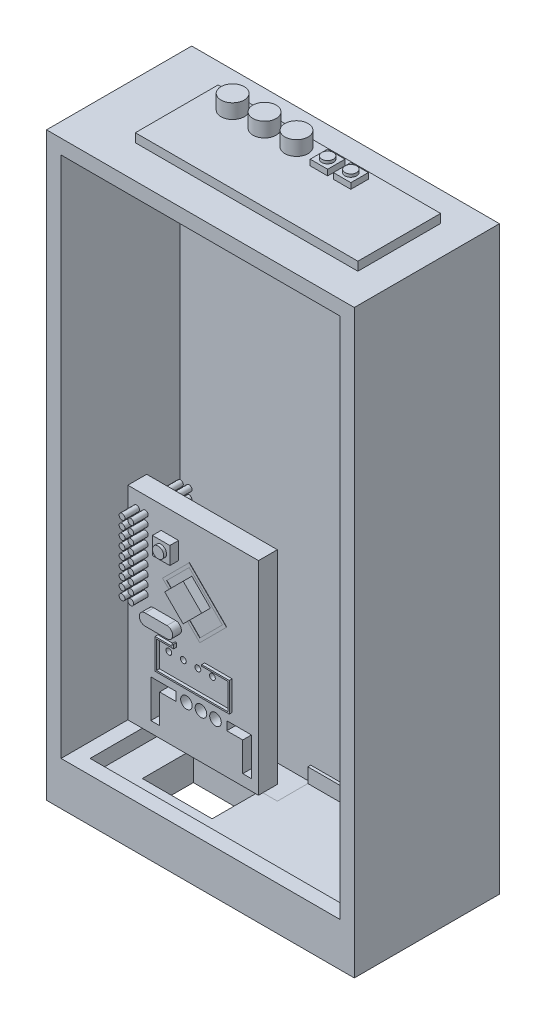
from build123d import *

# Parameters (mm, degrees)
SKETCH_1_W           = 106
SKETCH_1_H           = 45
EXTRUDE_1_DEPTH      = 200
SKETCH_2_W           = 86
SKETCH_2_H           = 180
CUT_EXTRUDE_1_DEPTH  = 35
SKETCH_4_W           = 24.030592061
SKETCH_4_H           = 7.207958271
CUT_EXTRUDE_4_DEPTH  = 35
SKETCH_5_W           = 106
SKETCH_5_H           = 200
EXTRUDE_2_DEPTH      = 5
SKETCH_6_W           = 96
SKETCH_6_H           = 180
CUT_EXTRUDE_5_DEPTH  = 41
SKETCH_7_W           = 45
SKETCH_7_H           = 70
EXTRUDE_3_DEPTH      = 18
SKETCH_8_W           = 24.030592061
SKETCH_8_H           = 17.559762173
CUT_EXTRUDE_6_DEPTH  = 15
SKETCH_9_R           = 3.5
CUT_EXTRUDE_7_DEPTH  = 211.926527492
SKETCH_11_W          = 6
SKETCH_11_H          = 6
SKETCH_11_R          = 1.925381926
EXTRUDE_5_DEPTH      = 3
SKETCH_12_R          = 1.925381926
EXTRUDE_6_DEPTH      = 1
EXTRUDE_7_DEPTH      = 3
EXTRUDE_12_DEPTH     = 3
SKETCH_23_R          = 2
CUT_EXTRUDE_8_DEPTH  = 12
EXTRUDE_1_2_DEPTH    = 0.1
SKETCH_25_W          = 45
SKETCH_25_H          = 5
CUT_EXTRUDE_9_DEPTH  = 75.1
SKETCH_26_W          = 45
SKETCH_26_H          = 6.5
CUT_EXTRUDE_10_DEPTH = 75.1
EXTRUDE_4_DEPTH      = 5
EXTRUDE_4_DEPTH_BACK = 15.1
SKETCH_10_R          = 1
EXTRUDE_14_DEPTH     = 1
SKETCH_28_R          = 1
CUT_EXTRUDE_11_DEPTH = 12.1
SKETCH_30_W          = 76.642846548
SKETCH_30_H          = 28.49978442
EXTRUDE_15_DEPTH     = 3
SKETCH_32_R          = 4
EXTRUDE_17_DEPTH     = 5
SKETCH_35_R          = 4
EXTRUDE_18_DEPTH     = 5
SKETCH_36_R          = 4
EXTRUDE_19_DEPTH     = 5
SKETCH_37_W          = 6
SKETCH_37_H          = 6
EXTRUDE_20_DEPTH     = 2
SKETCH_38_R          = 2
EXTRUDE_21_DEPTH     = 1
SKETCH_39_R          = 6
EXTRUDE_22_DEPTH     = 60
SKETCH_40_W          = 7.376516637
SKETCH_40_H          = 1.927531986
CUT_EXTRUDE_12_DEPTH = 23
SKETCH_41_W          = 4.263187749
SKETCH_41_H          = 1.482847913
CUT_EXTRUDE_13_DEPTH = 23
EXTRUDE_23_DEPTH     = 200
SKETCH_43_R          = 5.333844502
EXTRUDE_24_DEPTH     = 200
CUT_EXTRUDE_14_DEPTH = 207


with BuildPart() as part:
    # 草圖1 → Extrude 1 (new body)
    with BuildSketch(Plane(origin=(0, 0, 0), x_dir=(1, 0, 0), z_dir=(0, 1, 0))):
        Rectangle(SKETCH_1_W, SKETCH_1_H)
    extrude(amount=EXTRUDE_1_DEPTH)

    # 草圖2 → 除料-伸長1 (cut)
    with BuildSketch(Plane.XY.offset(22.5)):
        with Locations((0, 100)):
            Rectangle(SKETCH_2_W, SKETCH_2_H)
    extrude(amount=-CUT_EXTRUDE_1_DEPTH, mode=Mode.SUBTRACT)

    # 草圖4 → 除料-伸長4 (cut)
    with BuildSketch(Plane.XZ):
        with Locations((-20.984703969, 10.896020865)):
            Rectangle(SKETCH_4_W, SKETCH_4_H)
    extrude(amount=-CUT_EXTRUDE_4_DEPTH, mode=Mode.SUBTRACT)

    # 草圖5 → 填料-伸長2 (add)
    with BuildSketch(Plane.XY.offset(22.5)):
        with Locations((0, 100)):
            Rectangle(SKETCH_5_W, SKETCH_5_H)
    extrude(amount=EXTRUDE_2_DEPTH)

    # 草圖6 → 除料-伸長5 (cut)
    with BuildSketch(Plane.XY.offset(27.5)):
        with Locations((0, 105)):
            Rectangle(SKETCH_6_W, SKETCH_6_H)
    extrude(amount=-CUT_EXTRUDE_5_DEPTH, mode=Mode.SUBTRACT)

    # 草圖7 → 填料-伸長3 (add)
    with BuildSketch(Plane.XY.offset(-13.5)):
        with Locations((-25.5, 50)):
            Rectangle(SKETCH_7_W, SKETCH_7_H)
    extrude(amount=EXTRUDE_3_DEPTH)

    # 草圖8 → 除料-伸長6 (cut)
    with BuildSketch(Plane.XZ):
        with Locations((-20.984703969, 5.720118914)):
            Rectangle(SKETCH_8_W, SKETCH_8_H)
    extrude(amount=-CUT_EXTRUDE_6_DEPTH, mode=Mode.SUBTRACT)

    # 草圖9 → 除料-伸長7 (cut, through all)
    with BuildSketch(Plane.XY.offset(-13.5)):
        with Locations((-34, 185)):
            Circle(SKETCH_9_R)
        with Locations((-34, 175)):
            Circle(SKETCH_9_R)
        with Locations((34, 185)):
            Circle(SKETCH_9_R)
        with Locations((34, 175)):
            Circle(SKETCH_9_R)
    extrude(amount=-CUT_EXTRUDE_7_DEPTH, mode=Mode.SUBTRACT)

    # 草圖11 → 填料-伸長5 (add)
    with BuildSketch(Plane.XY.offset(4.5)):
        with Locations((-33.531491055, 74.249874948)):
            Rectangle(SKETCH_11_W, SKETCH_11_H)
        with Locations((-33.592516199, 74.152122505)):
            Circle(SKETCH_11_R, mode=Mode.SUBTRACT)
    extrude(amount=EXTRUDE_5_DEPTH)

    # 草圖14 → 填料-伸長7 (add)
    with BuildSketch(Plane.XY.offset(4.5)):
        Polygon((-32.310272291, 62.520068569), (-25.94631126, 68.8840296), (-19.582350229, 62.520068569), (-25.94631126, 56.156107538), align=None)
    extrude(amount=EXTRUDE_7_DEPTH)

    # 草圖22 → 填料-伸長12 (add)
    with BuildSketch(Plane.XY.offset(4.5)):
        with BuildLine():
            Line((-39.077631077, 52.868588224), (-31.528611444, 52.868588224))
            ThreePointArc((-31.528611444, 52.868588224), (-29.551487254, 50.891464034), (-31.528611444, 48.914339844))
            Line((-31.528611444, 48.914339844), (-39.077631077, 48.914339844))
            ThreePointArc((-39.077631077, 48.914339844), (-41.054755267, 50.891464034), (-39.077631077, 52.868588224))
        make_face()
    extrude(amount=EXTRUDE_12_DEPTH)

    # 草圖23 → 除料-伸長8 (cut)
    with BuildSketch(Plane.XY.offset(4.5)):
        with Locations((-27.814678515, 30.288524887)):
            Circle(SKETCH_23_R)
        with Locations((-22.814678515, 30.288524887)):
            Circle(SKETCH_23_R)
        with Locations((-17.814678515, 30.288524887)):
            Circle(SKETCH_23_R)
        Polygon((-40.074393657, 18.743194454), (-37.074393657, 18.743194454), (-37.074393657, 28.788524887), (-31.464475571, 28.788524887), (-31.464475571, 31.788524887), (-40.074393657, 31.788524887), align=None)
        Polygon((-8.423476487, 18.743194454), (-5.423476487, 18.743194454), (-5.423476487, 31.788524887), (-13.928865075, 31.788524887), (-13.928865075, 28.788524887), (-8.423476487, 28.788524887), align=None)
    extrude(amount=-CUT_EXTRUDE_8_DEPTH, mode=Mode.SUBTRACT)

    # 草圖24 → Extrude 1 2 (add)
    with BuildSketch(Plane.XY.offset(4.5)):
        Polygon((-26.761137533, 72.527282997), (-35.953525689, 63.334894842), (-23.117884135, 50.499253289), (-13.92549598, 59.691641444), align=None)
        Polygon((-26.761137533, 71.113069435), (-34.539312126, 63.334894842), (-23.117884135, 51.913466851), (-15.339709542, 59.691641444), align=None, mode=Mode.SUBTRACT)
    extrude(amount=EXTRUDE_1_2_DEPTH)

    # 草圖25 → 除料-伸長9 (cut)
    with BuildSketch(Plane(origin=(0, 85, 0), x_dir=(1, 0, 0), z_dir=(0, 1, 0))):
        with Locations((-25.5, 11)):
            Rectangle(SKETCH_25_W, SKETCH_25_H)
    extrude(amount=-CUT_EXTRUDE_9_DEPTH, mode=Mode.SUBTRACT)

    # 草圖26 → 除料-伸長10 (cut)
    with BuildSketch(Plane(origin=(0, 85, 0), x_dir=(1, 0, 0), z_dir=(0, 1, 0))):
        with Locations((-25.5, 5.25)):
            Rectangle(SKETCH_26_W, SKETCH_26_H)
    extrude(amount=-CUT_EXTRUDE_10_DEPTH, mode=Mode.SUBTRACT)

    # 草圖10 → 填料-伸長4 (add, two sides: drawn at the far end of the back side and taken through both)
    with BuildSketch(Plane.XY.offset(4.5).offset(-EXTRUDE_4_DEPTH_BACK)):
        with Locations((-45, 79.595847046)):
            Circle(SKETCH_10_R)
        with Locations((-42, 79.595847046)):
            Circle(SKETCH_10_R)
        with Locations((-45, 76.595847046)):
            Circle(SKETCH_10_R)
        with Locations((-42, 76.595847046)):
            Circle(SKETCH_10_R)
        with Locations((-45, 73.595847046)):
            Circle(SKETCH_10_R)
        with Locations((-42, 73.595847046)):
            Circle(SKETCH_10_R)
        with Locations((-45, 70.595847046)):
            Circle(SKETCH_10_R)
        with Locations((-42, 70.595847046)):
            Circle(SKETCH_10_R)
        with Locations((-45, 67.595847046)):
            Circle(SKETCH_10_R)
        with Locations((-42, 67.595847046)):
            Circle(SKETCH_10_R)
        with Locations((-45, 64.595847046)):
            Circle(SKETCH_10_R)
        with Locations((-42, 64.595847046)):
            Circle(SKETCH_10_R)
        with Locations((-45, 61.595847046)):
            Circle(SKETCH_10_R)
        with Locations((-42, 61.595847046)):
            Circle(SKETCH_10_R)
        with Locations((-45, 58.595847046)):
            Circle(SKETCH_10_R)
        with Locations((-42, 58.595847046)):
            Circle(SKETCH_10_R)
        with Locations((-45, 55.595847046)):
            Circle(SKETCH_10_R)
        with Locations((-42, 55.595847046)):
            Circle(SKETCH_10_R)
    extrude(amount=EXTRUDE_4_DEPTH + EXTRUDE_4_DEPTH_BACK)

    # 草圖27 → 填料-伸長14 (add)
    with BuildSketch(Plane.XY.offset(4.5)):
        Polygon((-31.203920225, 46.418342211), (-31.203920225, 45.064584038), (-37.135292794, 45.064584038), (-37.135292794, 35.684682041), (-12.561763296, 35.684682041), (-12.561763296, 44.710825865), (-21.548691432, 44.710825865), (-21.548691432, 45.210825865), (-12.061763296, 45.210825865), (-12.061763296, 35.184682041), (-37.635292794, 35.184682041), (-37.635292794, 45.564584038), (-31.703920225, 45.564584038), (-31.703920225, 46.418342211), align=None)
    extrude(amount=EXTRUDE_14_DEPTH)

    # 草圖28 → 除料-伸長11 (cut)
    with BuildSketch(Plane.XY.offset(4.5)):
        with Locations((-33.875530331, 42.407908174)):
            Circle(SKETCH_28_R)
        with Locations((-28.875530331, 42.407908174)):
            Circle(SKETCH_28_R)
        with Locations((-23.875530331, 42.407908174)):
            Circle(SKETCH_28_R)
        with Locations((-18.875530331, 42.407908174)):
            Circle(SKETCH_28_R)
    extrude(amount=-CUT_EXTRUDE_11_DEPTH, mode=Mode.SUBTRACT)

    # 草圖30 → 填料-伸長15 (add)
    with BuildSketch(Plane(origin=(0, 200, 0), x_dir=(1, 0, 0), z_dir=(0, 1, 0))):
        with Locations((4.482905335, -1.820850753)):
            Rectangle(SKETCH_30_W, SKETCH_30_H)
    extrude(amount=EXTRUDE_15_DEPTH)

    # 草圖32 → 填料-伸長17 (add)
    with BuildSketch(Plane(origin=(0, 203, 0), x_dir=(1, 0, 0), z_dir=(0, 1, 0))):
        with Locations(Location((-23.838517939, 7.429041457, 0), (0, 0, 270))):
            Circle(SKETCH_32_R)
    extrude(amount=EXTRUDE_17_DEPTH)

    # 草圖35 → 填料-伸長18 (add)
    with BuildSketch(Plane(origin=(0, 203, 0), x_dir=(1, 0, 0), z_dir=(0, 1, 0))):
        with Locations(Location((-12.838517939, 7.429041457, 0), (0, 0, 270))):
            Circle(SKETCH_35_R)
    extrude(amount=EXTRUDE_18_DEPTH)

    # 草圖36 → 填料-伸長19 (add)
    with BuildSketch(Plane(origin=(0, 203, 0), x_dir=(1, 0, 0), z_dir=(0, 1, 0))):
        with Locations(Location((-1.838517939, 7.429041457, 0), (0, 0, 270))):
            Circle(SKETCH_36_R)
    extrude(amount=EXTRUDE_19_DEPTH)

    # 草圖37 → 填料-伸長20 (add)
    with BuildSketch(Plane(origin=(0, 203, 0), x_dir=(1, 0, 0), z_dir=(0, 1, 0))):
        with Locations((9.161482061, 7.14731117)):
            Rectangle(SKETCH_37_W, SKETCH_37_H)
        with Locations((17.161482061, 7.14731117)):
            Rectangle(SKETCH_37_W, SKETCH_37_H)
    extrude(amount=EXTRUDE_20_DEPTH)

    # 草圖38 → 填料-伸長21 (add)
    with BuildSketch(Plane(origin=(0, 205, 0), x_dir=(1, 0, 0), z_dir=(0, 1, 0))):
        with Locations(Location((9.161482061, 7.14731117, 0), (0, 0, 270))):
            Circle(SKETCH_38_R)
        with Locations(Location((17.161482061, 7.14731117, 0), (0, 0, 270))):
            Circle(SKETCH_38_R)
    extrude(amount=EXTRUDE_21_DEPTH)

    # 草圖39 → 填料-伸長22 (add)
    with BuildSketch(Plane(origin=(0, 10, 0), x_dir=(1, 0, 0), z_dir=(0, 1, 0))):
        with Locations(Location((36, 5.5, 0), (0, 0, 90))):
            Circle(SKETCH_39_R)
    extrude(amount=EXTRUDE_22_DEPTH)

    # 草圖40 → 除料-伸長12 (cut)
    with BuildSketch(Plane(origin=(0, 70, 0), x_dir=(1, 0, 0), z_dir=(0, 1, 0))):
        with Locations((36.148613536, 2.965589645)):
            Rectangle(SKETCH_40_W, SKETCH_40_H)
    extrude(amount=-CUT_EXTRUDE_12_DEPTH, mode=Mode.SUBTRACT)

    # 草圖41 → 除料-伸長13 (cut)
    with BuildSketch(Plane(origin=(0, 70, 0), x_dir=(1, 0, 0), z_dir=(0, 1, 0))):
        with Locations((35.864121862, 8.188311076)):
            Rectangle(SKETCH_41_W, SKETCH_41_H)
    extrude(amount=-CUT_EXTRUDE_13_DEPTH, mode=Mode.SUBTRACT)



with BuildPart() as body_2:
    # 草圖12 → 填料-伸長6 (new body)
    with BuildSketch(Plane.XY.offset(7.5)):
        with Locations((-33.592516199, 74.152122505)):
            Circle(SKETCH_12_R)
    extrude(amount=EXTRUDE_6_DEPTH)


with BuildPart() as body_3:
    # 草圖42 → 填料-伸長23 (new body)
    with BuildSketch(Plane(origin=(0, 0, 0), x_dir=(1, 0, 0), z_dir=(0, 1, 0))):
        Polygon((-59.749343763, -30.11222935), (-55.785294408, -34.076278705), (-109.158387509, -87.449371805), (-113.122436863, -83.48532245), align=None)
    extrude(amount=EXTRUDE_23_DEPTH)


with BuildPart() as part_1:
    add(part.part)

    add(body_3.part)  # 填料-伸長24 merges body 3
    # 草圖43 → 填料-伸長24 (add)
    with BuildSketch(Plane(origin=(0, 200, 0), x_dir=(1, 0, 0), z_dir=(0, 1, 0))):
        with Locations((-56.348974797, -28.857914054)):
            Circle(SKETCH_43_R)
    extrude(amount=-EXTRUDE_24_DEPTH)

    # 草圖45 → 除料-伸長14 (cut)
    with BuildSketch(Plane(origin=(0, 200, 0), x_dir=(1, 0, 0), z_dir=(0, 1, 0))):
        Polygon((-51.19087761, -27.5), (-45.622451664, -33.068425945), (-108.609633107, -96.055607388), (-126.793281858, -77.871958636), (-59.105565365, -19.585312245), (-53, -24.706496828), (-53, -27.5), align=None)
    extrude(amount=-CUT_EXTRUDE_14_DEPTH, mode=Mode.SUBTRACT)


solid = Compound([body_2.part, part_1.part])
